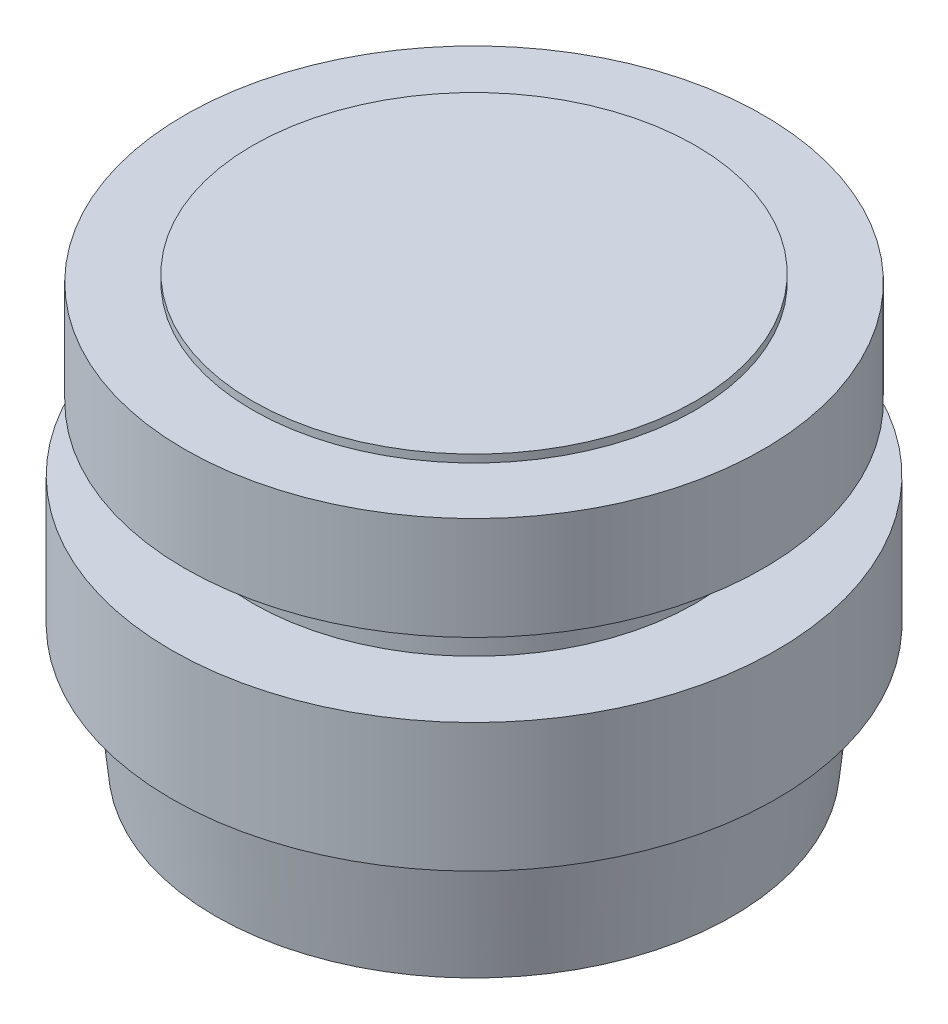
from build123d import *

# Parameters (mm, degrees)
SKETCH1_R      = 14.9225
EXTRUDE1_DEPTH = 6.35
SKETCH3_R      = 11.049
EXTRUDE2_DEPTH = 9.271
SKETCH5_R      = 10.922
EXTRUDE3_DEPTH = 8.636
SKETCH6_R      = 14.27627633
EXTRUDE4_DEPTH = 5.08
SKETCH7_R      = 13.395629592
SKETCH7_R_2    = 11.049
EXTRUDE5_DEPTH = 6.096
EXTRUDE5_DRAFT = 6


with BuildPart() as part:
    # Sketch1 → Extrude1 (new body)
    with BuildSketch(Plane(origin=(0, 0, 0), x_dir=(1, 0, 0), z_dir=(0, 1, 0))):
        with Locations(Location((0, 0, 0), (0, 0, 270))):
            Circle(SKETCH1_R)
    extrude(amount=EXTRUDE1_DEPTH)

    # Sketch3 → Extrude2 (add)
    with BuildSketch(Plane(origin=(0, -2.921, 0), x_dir=(0, 0, -1), z_dir=(0, 1, 0))):
        with Locations(Location((0, 0, 0), (0, 0, 180))):
            Circle(SKETCH3_R)
    extrude(amount=EXTRUDE2_DEPTH)

    # Sketch4 → Revolve1 (revolve)
    with BuildSketch(Plane(origin=(0, 0, 0), x_dir=(0, 0, 1), z_dir=(1, 0, 0)), mode=Mode.PRIVATE) as revolve1_sk:
        Polygon((-11.049, 2.921), (-14.336865125, -1.171616093), (-11.049, -1.171616093), align=None)
    revolve(revolve1_sk.sketch.rotate(Axis((0, 1.376246897, 0), (0, -1, 0)), 180), axis=Axis((0, 1.376246897, 0), (0, -1, 0)))

    # Sketch5 → Extrude3 (add)
    with BuildSketch(Plane(origin=(0, 6.35, 0), x_dir=(-1, 0, 0), z_dir=(0, 1, 0))):
        with Locations(Location((0, 0, 0), (0, 0, 90))):
            Circle(SKETCH5_R)
    extrude(amount=EXTRUDE3_DEPTH)

    # Sketch6 → Extrude4 (add)
    with BuildSketch(Plane.ZX.offset(9.525)):
        Circle(SKETCH6_R)
    extrude(amount=EXTRUDE4_DEPTH)


with BuildPart() as extrude5_tool:
    # Sketch7 → Extrude5 (with draft: the straight prism first)
    with BuildSketch(Plane.XZ):
        Circle(SKETCH7_R)
        Circle(SKETCH7_R_2, mode=Mode.SUBTRACT)
    extrude(amount=EXTRUDE5_DEPTH)
    # Extrude5: the draft: its side faces are tilted about the plane it starts from
    extrude5_sides = [extrude5_tool.faces().sort_by_distance(p)[0] for p in [
        (-13.395629592, -3.048, 0),
        (-11.049, -3.048, 0),
    ]]
    draft(extrude5_sides, Plane.XZ, EXTRUDE5_DRAFT)


with BuildPart() as part_1:
    add(part.part)

    # Extrude5: add extrude5_tool
    add(extrude5_tool.part)


solid = part_1.part
